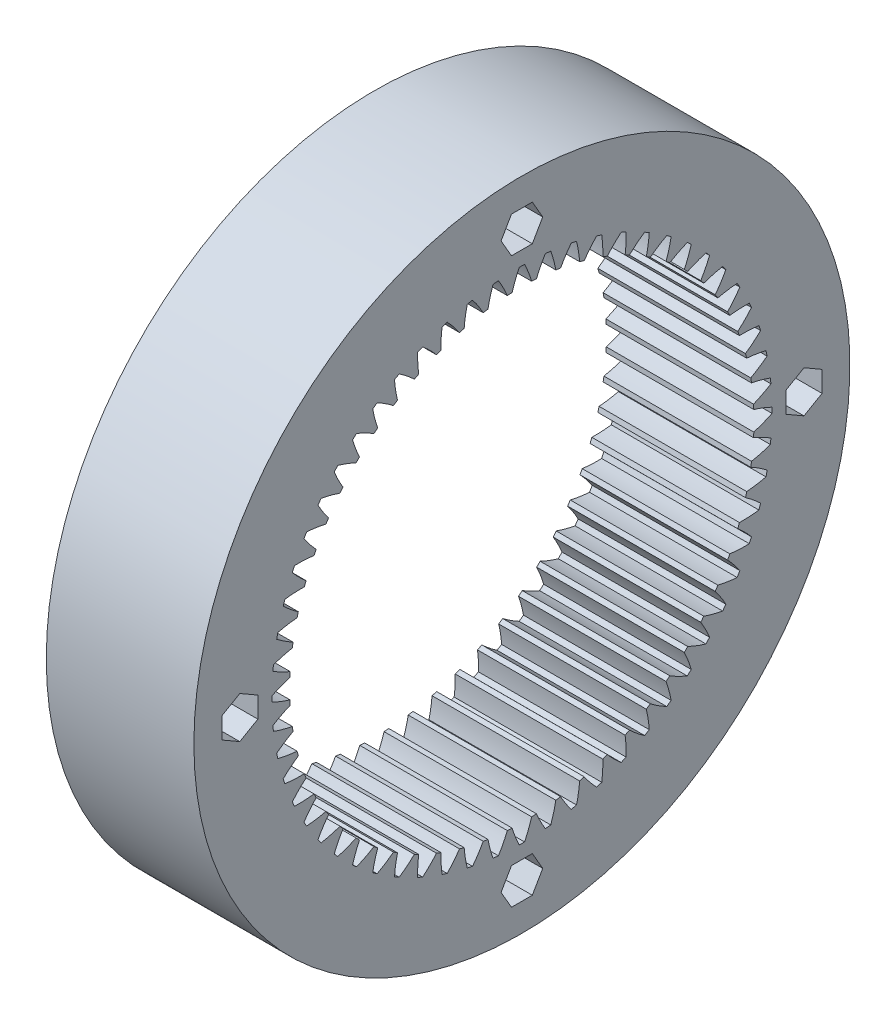
from build123d import *

# Parameters (mm, degrees)
BASPROSKE_W        = 22.5
BASPROSKE_H        = 14.62
TOOTHCUT_DEPTH     = 75.204110398
TEETHCUTS_COUNT    = 60
TEETHCUTS_ANGLE    = 354
SKETCH3_R          = 1.6
CUT_EXTRUDE2_DEPTH = 75.204110398
CUT_EXTRUDE3_DEPTH = 10


with BuildPart() as part:
    # BasProSke → Base-Revolve (revolve)
    with BuildSketch(Plane(origin=(0, 0, 0), x_dir=(1, 0, 0), z_dir=(0, 1, 0)), mode=Mode.PRIVATE) as base_revolve_sk:
        with Locations((11.25, 42.69)):
            Rectangle(BASPROSKE_W, BASPROSKE_H)
    revolve(base_revolve_sk.sketch.rotate(Axis((-10, 0, 0), (1, 0, 0)), 180), axis=Axis((-10, 0, 0), (1, 0, 0)))

    # TooCutSke → ToothCut (cut, through all)
    with BuildSketch(Plane(origin=(0, 0, 0), x_dir=(0, 0, -1), z_dir=(1, 0, 0))):
        with BuildLine():
            ThreePointArc((1.492319025, 35.323090537), (1.009165282, 36.745650772), (0.41095065, 38.123785168))
            ThreePointArc((0.41095065, 38.123785168), (0, 38.126), (-0.41095065, 38.123785168))
            ThreePointArc((-0.41095065, 38.123785168), (-1.009165282, 36.745650772), (-1.492319025, 35.323090537))
            ThreePointArc((-1.492319025, 35.323090537), (0, 35.3546), (1.492319025, 35.323090537))
        make_face()
    toothcut = extrude(amount=TOOTHCUT_DEPTH, mode=Mode.SUBTRACT)

    # TeethCuts: ToothCut ×60 about axis
    teethcuts_axis = Axis((-10, 0, 0), (1, 0, 0))
    for i in range(1, TEETHCUTS_COUNT):
        add(toothcut.rotate(teethcuts_axis, i * TEETHCUTS_ANGLE / (TEETHCUTS_COUNT - 1)), mode=Mode.SUBTRACT)

    # Sketch3 → Cut-Extrude2 (cut, through all)
    with BuildSketch(Plane.ZY):
        with Locations((43, 0)):
            Circle(SKETCH3_R)
        with Locations((0, 43)):
            Circle(SKETCH3_R)
        with Locations((0, -43)):
            Circle(SKETCH3_R)
        with Locations((-43, 0)):
            Circle(SKETCH3_R)
    extrude(amount=-CUT_EXTRUDE2_DEPTH, mode=Mode.SUBTRACT)

    # Sketch4 → Cut-Extrude3 (cut)
    with BuildSketch(Plane(origin=(22.5, 0, 0), x_dir=(0, 0, -1), z_dir=(1, 0, 0))):
        Polygon((1.58771324, -40.25), (-1.58771324, -40.25), (-3.175426481, -43), (-1.58771324, -45.75), (1.58771324, -45.75), (3.175426481, -43), align=None)
        Polygon((43, 3.175426481), (40.25, 1.58771324), (40.25, -1.58771324), (43, -3.175426481), (45.75, -1.58771324), (45.75, 1.58771324), align=None)
        Polygon((3.175426481, 43), (1.58771324, 45.75), (-1.58771324, 45.75), (-3.175426481, 43), (-1.58771324, 40.25), (1.58771324, 40.25), align=None)
        Polygon((-43, 3.175426481), (-45.75, 1.58771324), (-45.75, -1.58771324), (-43, -3.175426481), (-40.25, -1.58771324), (-40.25, 1.58771324), align=None)
    extrude(amount=-CUT_EXTRUDE3_DEPTH, mode=Mode.SUBTRACT)


solid = part.part
